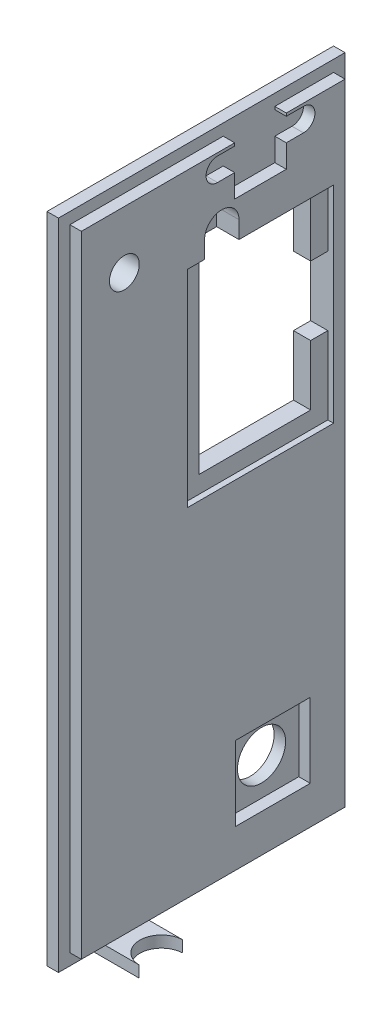
from build123d import *

# Parameters (mm, degrees)
SKIZZE1_W                        = 50
SKIZZE1_H                        = 114
AUFSATZ_LINEAR_AUSTRAGEN1_DEPTH  = 2
SKIZZE2_W                        = 46
SKIZZE2_H                        = 110
AUFSATZ_LINEAR_AUSTRAGEN2_DEPTH  = 2
SCHNITT_LINEAR_AUSTRAGEN1_REACH  = 106.213
SKIZZE3_W                        = 19.5
SKIZZE3_H                        = 33
SKIZZE4_W                        = 25.5
SKIZZE4_H                        = 33
SCHNITT_LINEAR_AUSTRAGEN2_DEPTH  = 1
SKIZZE5_R                        = 3
SCHNITT_LINEAR_AUSTRAGEN3_DEPTH  = 3.9
SCHNITT_LINEAR_AUSTRAGEN4_REACH  = 106.18
SKIZZE6_W                        = 3
SKIZZE6_H                        = 12
SKIZZE10_W                       = 9
SKIZZE10_H                       = 4
SCHNITT_LINEAR_AUSTRAGEN5_DEPTH  = 2
SKIZZE11_R                       = 2
SCHNITT_LINEAR_AUSTRAGEN6_DEPTH  = 2
SKIZZE13_R                       = 2.6
SCHNITT_LINEAR_AUSTRAGEN7_DEPTH  = 105.213135755
SKIZZE14_W                       = 7.6
SKIZZE14_H                       = 2
AUFSATZ_LINEAR_AUSTRAGEN3_DEPTH  = 8
SCHNITT_LINEAR_AUSTRAGEN8_REACH  = 120.273
SKIZZE15_R                       = 3.8033663
SKIZZE16_W                       = 25.5
SKIZZE16_H                       = 3
SCHNITT_LINEAR_AUSTRAGEN10_DEPTH = 1
SKIZZE21_W                       = 13
SKIZZE21_H                       = 13
SCHNITT_LINEAR_AUSTRAGEN11_DEPTH = 2
SCHNITT_LINEAR_AUSTRAGEN12_REACH = 106.431
SKIZZE22_R                       = 4.2
SKIZZE23_W                       = 3
SKIZZE23_H                       = 4
SCHNITT_LINEAR_AUSTRAGEN13_DEPTH = 2
SKIZZE26_W                       = 9
SKIZZE26_H                       = 4.5
SCHNITT_LINEAR_AUSTRAGEN18_DEPTH = 2


with BuildPart() as part:
    # Skizze1 → Aufsatz-Linear austragen1 (new body)
    with BuildSketch(Plane(origin=(0, 0, 0), x_dir=(0, 0, -1), z_dir=(1, 0, 0))):
        with Locations((4.873417722, -42.759493671)):
            Rectangle(SKIZZE1_W, SKIZZE1_H)
    extrude(amount=AUFSATZ_LINEAR_AUSTRAGEN1_DEPTH)

    # Skizze2 → Aufsatz-Linear austragen2 (add)
    with BuildSketch(Plane(origin=(2, 0, 0), x_dir=(0, 0, -1), z_dir=(1, 0, 0))):
        with Locations((4.873417722, -42.759493671)):
            Rectangle(SKIZZE2_W, SKIZZE2_H)
    extrude(amount=AUFSATZ_LINEAR_AUSTRAGEN2_DEPTH)

    # Skizze3 → Schnitt-Linear austragen1 (cut, up to next)
    with BuildSketch(Plane(origin=(4, 0, 0), x_dir=(0, 0, -1), z_dir=(1, 0, 0)), mode=Mode.PRIVATE) as schnitt_linear_austragen1_sk1:
        with Locations((13.123417722, -19.259493671)):
            Rectangle(SKIZZE3_W, SKIZZE3_H)
    schnitt_linear_austragen1_tool1 = extrude(schnitt_linear_austragen1_sk1.sketch, amount=-SCHNITT_LINEAR_AUSTRAGEN1_REACH, mode=Mode.PRIVATE) & part.part
    add(schnitt_linear_austragen1_tool1.solids().sort_by_distance((4, -19.259494, -13.123418))[0], mode=Mode.SUBTRACT)

    # Skizze4 → Schnitt-Linear austragen2 (cut)
    with BuildSketch(Plane(origin=(4, 0, 0), x_dir=(0, 0, -1), z_dir=(1, 0, 0))):
        with Locations((13.123417722, -19.259493671)):
            Rectangle(SKIZZE4_W, SKIZZE4_H)
    extrude(amount=-SCHNITT_LINEAR_AUSTRAGEN2_DEPTH, mode=Mode.SUBTRACT)

    # Skizze5 → Schnitt-Linear austragen3 (cut)
    with BuildSketch(Plane(origin=(4, 0, 0), x_dir=(0, 0, -1), z_dir=(1, 0, 0))):
        with BuildLine():
            ThreePointArc((9.373417722, 0.250506329), (6.498780388, -2.746873227), (3.38389492, 0))
            Line((3.38389492, 0), (3.373417722, -2.759493671))
            Line((3.373417722, -2.759493671), (9.373417722, -2.759493671))
            Line((9.373417722, -2.759493671), (9.373417722, 0.250506329))
        make_face()
        with Locations((6.373417722, 0.250506329)):
            Circle(SKIZZE5_R)
    extrude(amount=-SCHNITT_LINEAR_AUSTRAGEN3_DEPTH, mode=Mode.SUBTRACT)

    # Skizze6 → Schnitt-Linear austragen4 (cut, up to next)
    with BuildSketch(Plane(origin=(3, 0, 0), x_dir=(0, 0, -1), z_dir=(1, 0, 0)), mode=Mode.PRIVATE) as schnitt_linear_austragen4_sk1:
        with Locations((24.373417722, -19.259493671)):
            Rectangle(SKIZZE6_W, SKIZZE6_H)
    schnitt_linear_austragen4_tool1 = extrude(schnitt_linear_austragen4_sk1.sketch, amount=-SCHNITT_LINEAR_AUSTRAGEN4_REACH, mode=Mode.PRIVATE) & part.part
    add(schnitt_linear_austragen4_tool1.solids().sort_by_distance((3, -19.259494, -24.373418))[0], mode=Mode.SUBTRACT)

    # Skizze10 → Schnitt-Linear austragen5 (cut)
    with BuildSketch(Plane(origin=(4, 0, 0), x_dir=(0, 0, -1), z_dir=(1, 0, 0))):
        with Locations((13.123417722, 10.240506329)):
            Rectangle(SKIZZE10_W, SKIZZE10_H)
    extrude(amount=-SCHNITT_LINEAR_AUSTRAGEN5_DEPTH, mode=Mode.SUBTRACT)

    # Skizze11 → Schnitt-Linear austragen6 (cut)
    with BuildSketch(Plane(origin=(4, 0, 0), x_dir=(0, 0, -1), z_dir=(1, 0, 0))):
        with Locations((20.623417722, 9.740506329)):
            Circle(SKIZZE11_R)
        with Locations((5.623417722, 9.740506329)):
            Circle(SKIZZE11_R)
    extrude(amount=-SCHNITT_LINEAR_AUSTRAGEN6_DEPTH, mode=Mode.SUBTRACT)

    # Skizze13 → Schnitt-Linear austragen7 (cut, through all)
    with BuildSketch(Plane(origin=(4, 0, 0), x_dir=(0, 0, -1), z_dir=(1, 0, 0))):
        with Locations((-10.626582278, 2.240506329)):
            Circle(SKIZZE13_R)
    extrude(amount=-SCHNITT_LINEAR_AUSTRAGEN7_DEPTH, mode=Mode.SUBTRACT)

    # Skizze14 → Aufsatz-Linear austragen3 (add)
    with BuildSketch(Plane(origin=(2, 0, 0), x_dir=(0, 0, -1), z_dir=(1, 0, 0))):
        with Locations((-10.126582278, -98.759493671)):
            Rectangle(SKIZZE14_W, SKIZZE14_H)
    extrude(amount=AUFSATZ_LINEAR_AUSTRAGEN3_DEPTH)

    # Skizze15 → Schnitt-Linear austragen8 (cut, up to next)
    with BuildSketch(Plane.XZ.offset(99.759493671), mode=Mode.PRIVATE) as schnitt_linear_austragen8_sk1:
        with Locations((10, 10.126582278)):
            Circle(SKIZZE15_R)
    schnitt_linear_austragen8_tool1 = extrude(schnitt_linear_austragen8_sk1.sketch, amount=-SCHNITT_LINEAR_AUSTRAGEN8_REACH, mode=Mode.PRIVATE) & part.part
    add(schnitt_linear_austragen8_tool1.solids().sort_by_distance((10, -99.759494, 10.126582))[0], mode=Mode.SUBTRACT)

    # Skizze16 → Schnitt-Linear austragen10 (cut)
    with BuildSketch(Plane(origin=(4, 0, 0), x_dir=(0, 0, -1), z_dir=(1, 0, 0))):
        with Locations((13.123417722, -37.259493671)):
            Rectangle(SKIZZE16_W, SKIZZE16_H)
    extrude(amount=-SCHNITT_LINEAR_AUSTRAGEN10_DEPTH, mode=Mode.SUBTRACT)

    # Skizze21 → Schnitt-Linear austragen11 (cut)
    with BuildSketch(Plane(origin=(4, 0, 0), x_dir=(0, 0, -1), z_dir=(1, 0, 0))):
        with Locations((15.306102693, -84.632709468)):
            Rectangle(SKIZZE21_W, SKIZZE21_H)
    extrude(amount=-SCHNITT_LINEAR_AUSTRAGEN11_DEPTH, mode=Mode.SUBTRACT)

    # Skizze22 → Schnitt-Linear austragen12 (cut, up to next)
    with BuildSketch(Plane(origin=(2, 0, 0), x_dir=(0, 0, -1), z_dir=(1, 0, 0)), mode=Mode.PRIVATE) as schnitt_linear_austragen12_sk1:
        with Locations((15.306102693, -84.632709468)):
            Circle(SKIZZE22_R)
    schnitt_linear_austragen12_tool1 = extrude(schnitt_linear_austragen12_sk1.sketch, amount=-SCHNITT_LINEAR_AUSTRAGEN12_REACH, mode=Mode.PRIVATE) & part.part
    add(schnitt_linear_austragen12_tool1.solids().sort_by_distance((2, -84.632709, -15.306103))[0], mode=Mode.SUBTRACT)

    # Skizze23 → Schnitt-Linear austragen13 (cut)
    with BuildSketch(Plane(origin=(4, 0, 0), x_dir=(0, 0, -1), z_dir=(1, 0, 0))):
        with Locations((7.123417722, 9.740506329)):
            Rectangle(SKIZZE23_W, SKIZZE23_H)
        with Locations((19.123417722, 9.740506329)):
            Rectangle(SKIZZE23_W, SKIZZE23_H)
    extrude(amount=-SCHNITT_LINEAR_AUSTRAGEN13_DEPTH, mode=Mode.SUBTRACT)

    # Skizze26 → Schnitt-Linear austragen18 (cut)
    with BuildSketch(Plane(origin=(4, 0, 0), x_dir=(0, 0, -1), z_dir=(1, 0, 0))):
        with Locations((13.123417722, 5.990506329)):
            Rectangle(SKIZZE26_W, SKIZZE26_H)
    extrude(amount=-SCHNITT_LINEAR_AUSTRAGEN18_DEPTH, mode=Mode.SUBTRACT)


solid = part.part
